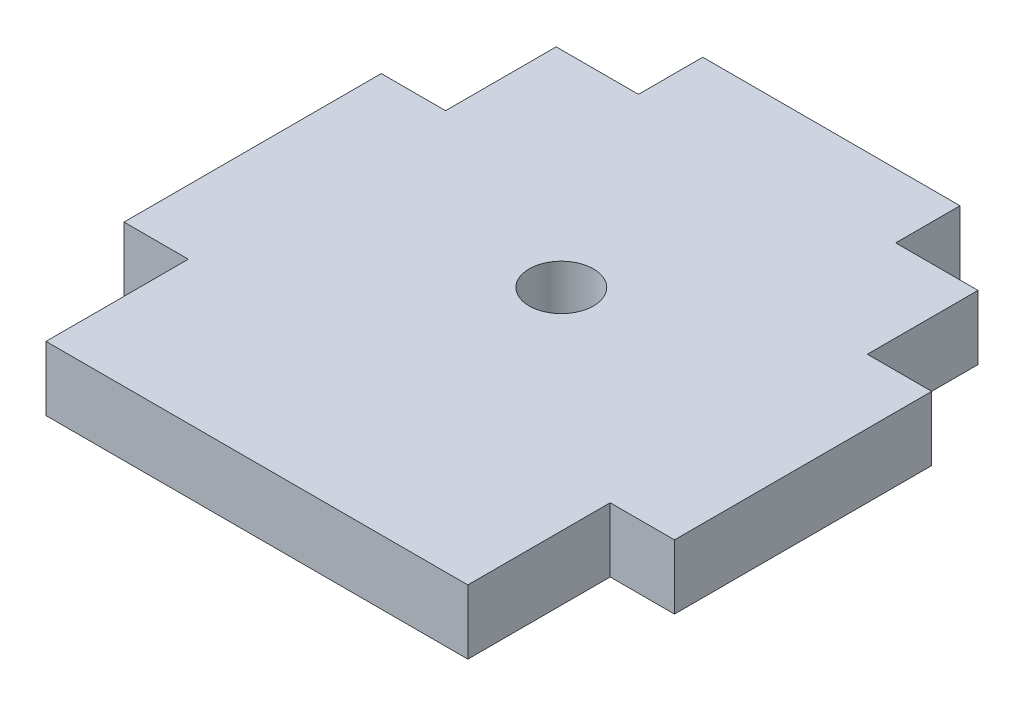
from build123d import *

# Parameters (mm, degrees)
SKETCH1_R      = 3.175
EXTRUDE1_DEPTH = 6.35


with BuildPart() as part:
    # Sketch1 → Extrude1 (new body)
    with BuildSketch(Plane(origin=(0, 0, 0), x_dir=(1, 0, 0), z_dir=(0, 1, 0))):
        Polygon((8.128, 50.376666667), (8.128, 56.726666667), (33.528, 56.726666667), (33.528, 50.376666667), (41.656, 50.376666667), (41.656, 39.454666667), (48.006, 39.454666667), (48.006, 14.054666667), (41.656, 14.054666667), (41.656, 0), (0, 0), (0, 14.054666667), (-6.35, 14.054666667), (-6.35, 39.454666667), (0, 39.454666667), (0, 50.376666667), align=None)
        with Locations(Location((20.828, 30.056666667, 0), (0, 0, 270))):
            Circle(SKETCH1_R, mode=Mode.SUBTRACT)
    extrude(amount=EXTRUDE1_DEPTH)


solid = part.part
